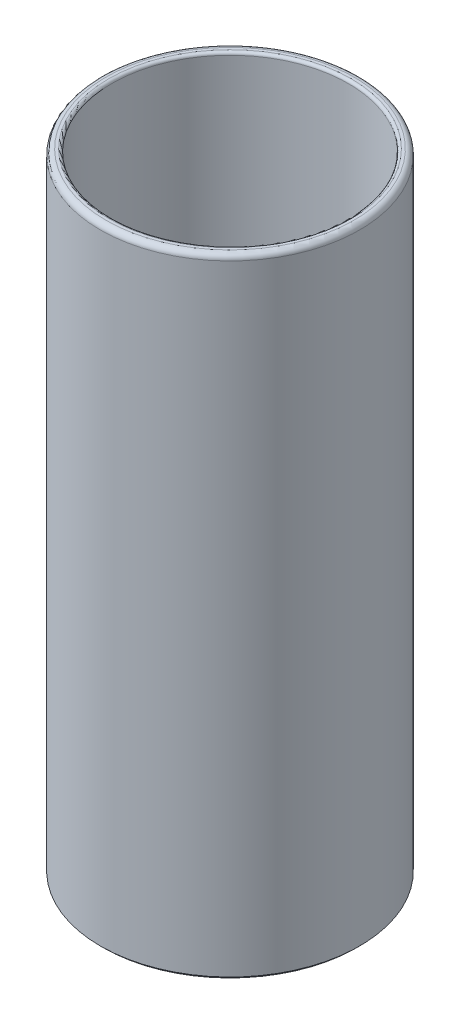
from build123d import *

# Parameters (mm, degrees)
SKETCH1_R           = 46.2
BOSS_EXTRUDE1_DEPTH = 224
SHELL1_T            = -4
FILLET1_R           = 2
FILLET2_R           = 2
FILLET3_R           = 1
CHAMFER1_SIZE       = 1


with BuildPart() as part:
    # Sketch1 → Boss-Extrude1 (new body)
    with BuildSketch(Plane(origin=(0, 0, 0), x_dir=(1, 0, 0), z_dir=(0, 1, 0))):
        with Locations(Location((0, 0, 0), (0, 0, 270))):
            Circle(SKETCH1_R)
    extrude(amount=BOSS_EXTRUDE1_DEPTH)

    # Shell1
    shell1_openings = [part.faces().sort_by_distance(p)[0] for p in [
        (0, 224, 0),
    ]]
    offset(amount=SHELL1_T, openings=shell1_openings, kind=Kind.INTERSECTION)

    # Fillet1
    fillet1_edges = [part.edges().sort_by_distance(p)[0] for p in [
        (0, 4, -42.2),
    ]]
    fillet(fillet1_edges, radius=FILLET1_R)

    # Fillet2
    fillet2_edges = [part.edges().sort_by_distance(p)[0] for p in [
        (0, 224, -46.2),
    ]]
    fillet(fillet2_edges, radius=FILLET2_R)

    # Fillet3
    fillet3_edges = [part.edges().sort_by_distance(p)[0] for p in [
        (0, 224, -42.2),
    ]]
    fillet(fillet3_edges, radius=FILLET3_R)

    # Chamfer1
    chamfer1_edges = [part.edges().sort_by_distance(p)[0] for p in [
        (0, 0, -46.2),
    ]]
    chamfer(chamfer1_edges, length=CHAMFER1_SIZE)


solid = part.part
